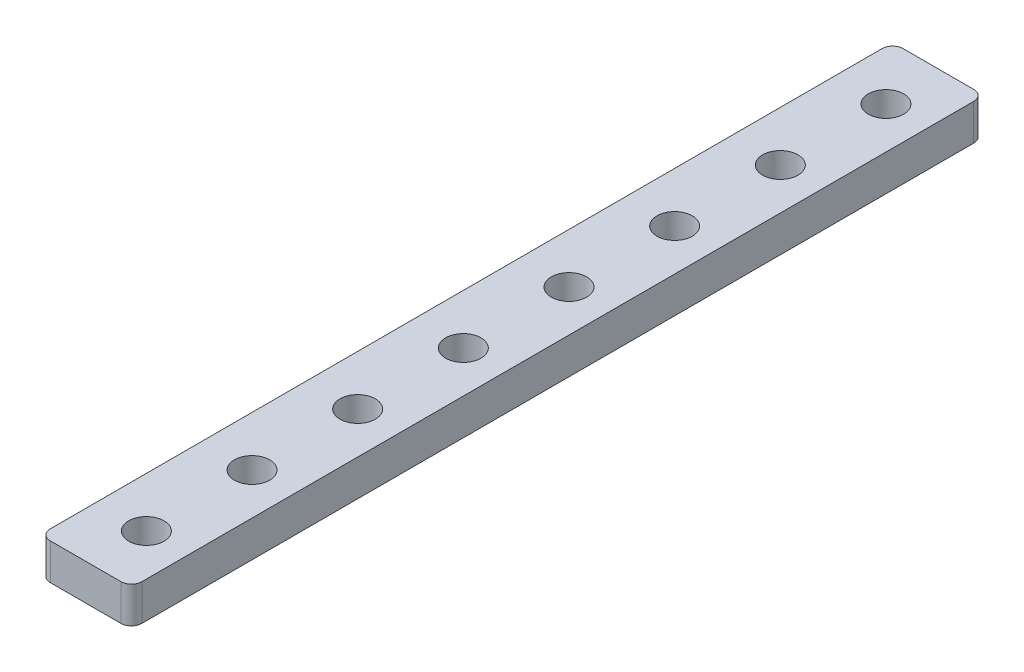
from build123d import *

# Parameters (mm, degrees)
SKETCH1_W            = 22
SKETCH1_H            = 205
BOSS_EXTRUDE1_DEPTH  = 8.7
M8_CLEARANCE_HOLE1_D = 8.5
LPATTERN1_COUNT      = 8
LPATTERN1_PITCH      = 25.4
FILLET1_R            = 2.5


with BuildPart() as part:
    # Sketch1 → Boss-Extrude1 (new body)
    with BuildSketch(Plane(origin=(0, 0, 0), x_dir=(1, 0, 0), z_dir=(0, 1, 0))):
        with Locations((-1, 0)):
            Rectangle(SKETCH1_W, SKETCH1_H)
    extrude(amount=BOSS_EXTRUDE1_DEPTH)

    # M8 Clearance Hole1 (through all)
    with Locations(Plane.XZ):
        with Locations((0, 88.9)):
            m8_clearance_hole1 = Hole(M8_CLEARANCE_HOLE1_D / 2)

    # LPattern1: M8 Clearance Hole1 ×8
    with Locations(*[(0, 0, -i * LPATTERN1_PITCH) for i in range(1, LPATTERN1_COUNT)]):
        add(m8_clearance_hole1, mode=Mode.SUBTRACT)

    # Fillet1
    fillet1_edges = [part.edges().sort_by_distance(p)[0] for p in [
        (10, 4.35, 102.5),
        (-12, 4.35, 102.5),
        (-12, 4.35, -102.5),
        (10, 4.35, -102.5),
    ]]
    fillet(fillet1_edges, radius=FILLET1_R)


solid = part.part
